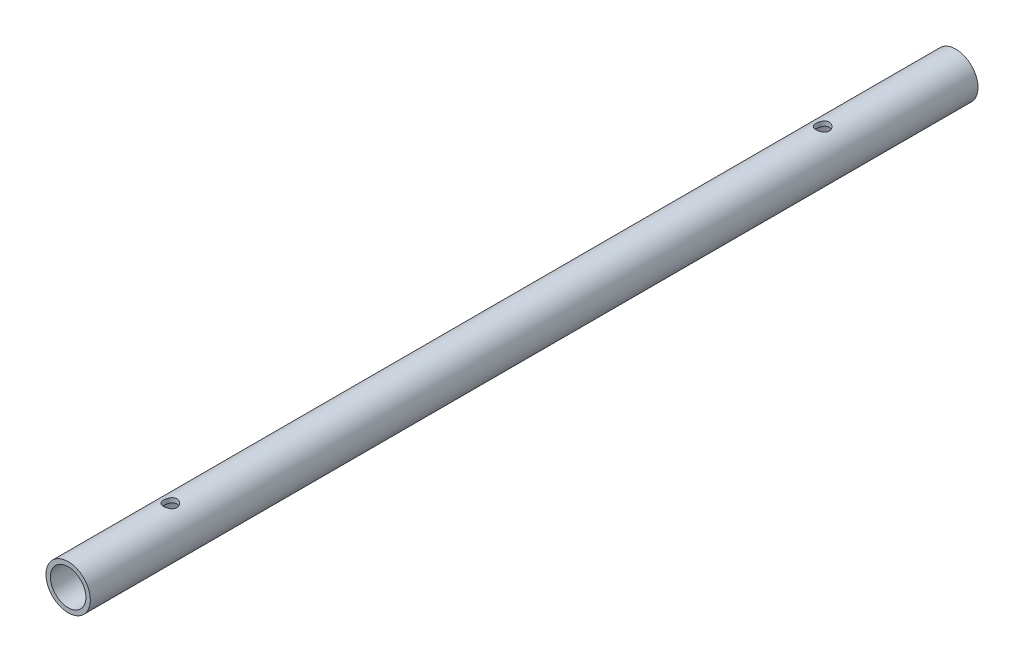
from build123d import *

# Parameters (mm, degrees)
SKETCH_1_R          = 5
SKETCH_1_R_2        = 4
EXTRUDE_1_DEPTH     = 200
SKETCH_2_R          = 1.5
CUT_EXTRUDE_1_DEPTH = 201.124960962


with BuildPart() as part:
    # 草图1 → 凸台-拉伸1 (new body)
    with BuildSketch(Plane.XY):
        Circle(SKETCH_1_R)
        Circle(SKETCH_1_R_2, mode=Mode.SUBTRACT)
    extrude(amount=EXTRUDE_1_DEPTH)

    # 草图2 → 切除-拉伸1 (cut, through all)
    with BuildSketch(Plane(origin=(0, 0, 0), x_dir=(1, 0, 0), z_dir=(0, 1, 0))):
        with Locations(Location((0, -177, 0), (0, 0, 90))):
            Circle(SKETCH_2_R)
        with Locations(Location((0, -30, 0), (0, 0, 90))):
            Circle(SKETCH_2_R)
    extrude(amount=CUT_EXTRUDE_1_DEPTH, mode=Mode.SUBTRACT)


solid = part.part
